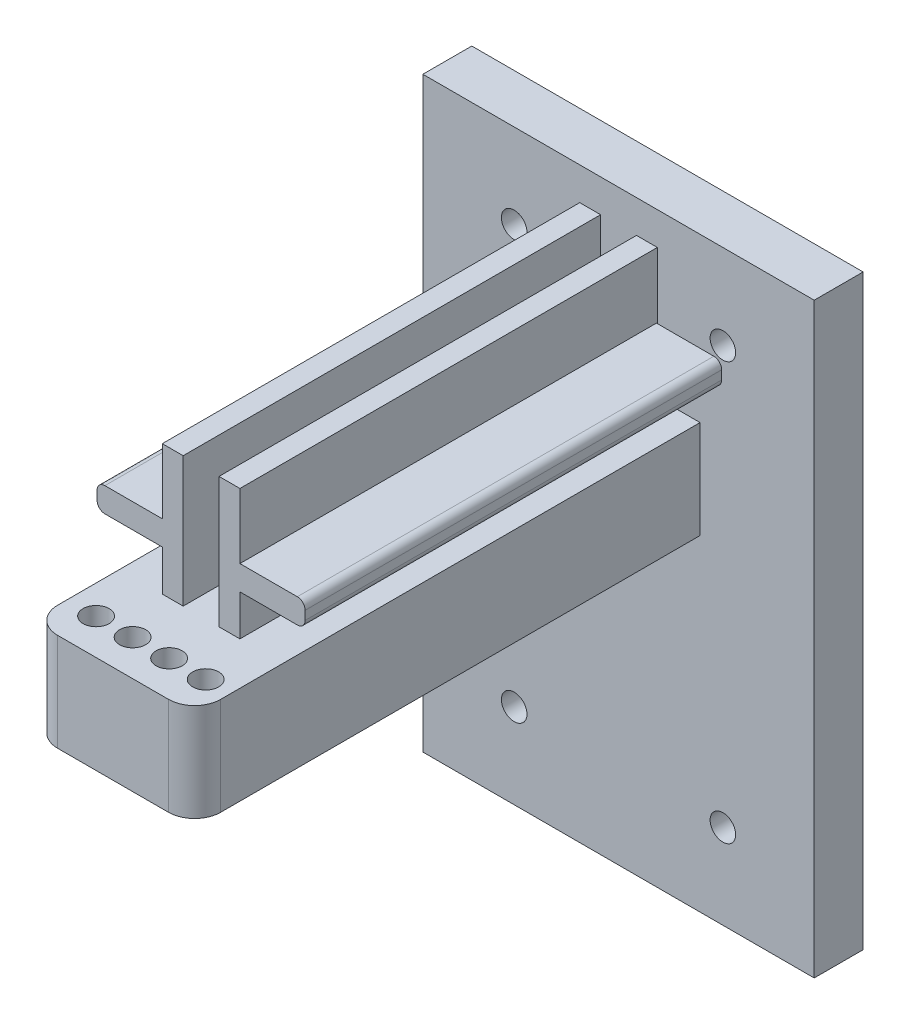
from build123d import *

# Parameters (mm, degrees)
SKETCH1_W            = 38.1
SKETCH1_H            = 57.15
BOSS_EXTRUDE1_DEPTH  = 4.7625
SKETCH2_R            = 1.2446
CUT_EXTRUDE1_DEPTH   = 4.7625
SKETCH4_W            = 15.875
SKETCH4_H            = 9.525
BOSS_EXTRUDE2_DEPTH  = 49.2125
CUT_EXTRUDE2_REACH   = 72.568
SKETCH5_R            = 1.27
FILLET2_R            = 2.54
SKETCH8_W            = 2.032
SKETCH8_H            = 12.684715198
BOSS_EXTRUDE4_DEPTH  = 40.64
SKETCH9_W            = 40.552264906
SKETCH9_H            = 2.38125
BOSS_EXTRUDE5_DEPTH  = 6.35
FILLET4_R            = 0.762
FILLET4_OF_MIRROR2_R = 0.762


with BuildPart() as part:
    # Sketch1 → Boss-Extrude1 (new body)
    with BuildSketch(Plane.XY):
        Rectangle(SKETCH1_W, SKETCH1_H)
    extrude(amount=BOSS_EXTRUDE1_DEPTH)

    # Sketch2 → Cut-Extrude1 (cut)
    with BuildSketch(Plane.XY):
        with Locations(Location((10.16, 20.32, 0), (0, 0, 180))):
            Circle(SKETCH2_R)
        with Locations(Location((-10.16, 20.32, 0), (0, 0, 180))):
            Circle(SKETCH2_R)
        with Locations(Location((10.16, -20.32, 0), (0, 0, 180))):
            Circle(SKETCH2_R)
        with Locations(Location((-10.16, -20.32, 0), (0, 0, 180))):
            Circle(SKETCH2_R)
    extrude(amount=CUT_EXTRUDE1_DEPTH, mode=Mode.SUBTRACT)

    # Sketch4 → Boss-Extrude2 (add)
    with BuildSketch(Plane.XY.offset(4.7625)):
        with Locations((0, 7.9375)):
            Rectangle(SKETCH4_W, SKETCH4_H)
    extrude(amount=BOSS_EXTRUDE2_DEPTH)

    # Sketch5 → Cut-Extrude2 (cut, up to next)
    with BuildSketch(Plane(origin=(0, 12.7, 0), x_dir=(1, 0, 0), z_dir=(0, 1, 0)), mode=Mode.PRIVATE) as cut_extrude2_sk1:
        with Locations(Location((-5.1435, -50.4825, 0), (0, 0, 180))):
            Circle(SKETCH5_R)
    cut_extrude2_tool1 = extrude(cut_extrude2_sk1.sketch, amount=-CUT_EXTRUDE2_REACH, mode=Mode.PRIVATE) & part.part
    # Sketch5 → Cut-Extrude2 (cut, up to next)
    with BuildSketch(Plane(origin=(0, 12.7, 0), x_dir=(1, 0, 0), z_dir=(0, 1, 0)), mode=Mode.PRIVATE) as cut_extrude2_sk2:
        with Locations(Location((-1.5875, -50.4825, 0), (0, 0, 180))):
            Circle(SKETCH5_R)
    cut_extrude2_tool2 = extrude(cut_extrude2_sk2.sketch, amount=-CUT_EXTRUDE2_REACH, mode=Mode.PRIVATE) & part.part
    # Sketch5 → Cut-Extrude2 (cut, up to next)
    with BuildSketch(Plane(origin=(0, 12.7, 0), x_dir=(1, 0, 0), z_dir=(0, 1, 0)), mode=Mode.PRIVATE) as cut_extrude2_sk3:
        with Locations(Location((1.9685, -50.4825, 0), (0, 0, 180))):
            Circle(SKETCH5_R)
    cut_extrude2_tool3 = extrude(cut_extrude2_sk3.sketch, amount=-CUT_EXTRUDE2_REACH, mode=Mode.PRIVATE) & part.part
    # Sketch5 → Cut-Extrude2 (cut, up to next)
    with BuildSketch(Plane(origin=(0, 12.7, 0), x_dir=(1, 0, 0), z_dir=(0, 1, 0)), mode=Mode.PRIVATE) as cut_extrude2_sk4:
        with Locations(Location((5.5245, -50.4825, 0), (0, 0, 180))):
            Circle(SKETCH5_R)
    cut_extrude2_tool4 = extrude(cut_extrude2_sk4.sketch, amount=-CUT_EXTRUDE2_REACH, mode=Mode.PRIVATE) & part.part
    add(cut_extrude2_tool1.solids().sort_by_distance((-5.1435, 12.7, 50.4825))[0], mode=Mode.SUBTRACT)
    add(cut_extrude2_tool2.solids().sort_by_distance((-1.5875, 12.7, 50.4825))[0], mode=Mode.SUBTRACT)
    add(cut_extrude2_tool3.solids().sort_by_distance((1.9685, 12.7, 50.4825))[0], mode=Mode.SUBTRACT)
    add(cut_extrude2_tool4.solids().sort_by_distance((5.5245, 12.7, 50.4825))[0], mode=Mode.SUBTRACT)

    # Fillet2
    fillet2_edges = [part.edges().sort_by_distance(p)[0] for p in [
        (-7.9375, 7.9375, 53.975),
        (7.9375, 7.9375, 53.975),
    ]]
    fillet(fillet2_edges, radius=FILLET2_R)

    # Sketch8 → Boss-Extrude4 (add)
    with BuildSketch(Plane.XY.offset(4.7625)):
        with Locations((-2.76225, 19.042357599)):
            Rectangle(SKETCH8_W, SKETCH8_H)
        with Locations((2.76225, 19.042357599)):
            Rectangle(SKETCH8_W, SKETCH8_H)
    extrude(amount=BOSS_EXTRUDE4_DEPTH)

    # Sketch9 → Boss-Extrude5 (add)
    with BuildSketch(Plane.ZY.offset(3.77825)):
        with Locations((25.126367547, 17.859375)):
            Rectangle(SKETCH9_W, SKETCH9_H)
    boss_extrude5 = extrude(amount=BOSS_EXTRUDE5_DEPTH)

    # Fillet4
    fillet4_edges = [part.edges().sort_by_distance(p)[0] for p in [
        (-10.12825, 19.05, 25.126367547),
        (-10.12825, 16.66875, 25.126367547),
    ]]
    fillet(fillet4_edges, radius=FILLET4_R)

    # Mirror2: Boss-Extrude5 across plane
    add(boss_extrude5.mirror(Plane.ZY))

    # Fillet4 of Mirror2
    fillet4_of_mirror2_edges = [part.edges().sort_by_distance(p)[0] for p in [
        (10.12825, 19.05, 25.126367547),
        (10.12825, 16.66875, 25.126367547),
    ]]
    fillet(fillet4_of_mirror2_edges, radius=FILLET4_OF_MIRROR2_R)


solid = part.part
